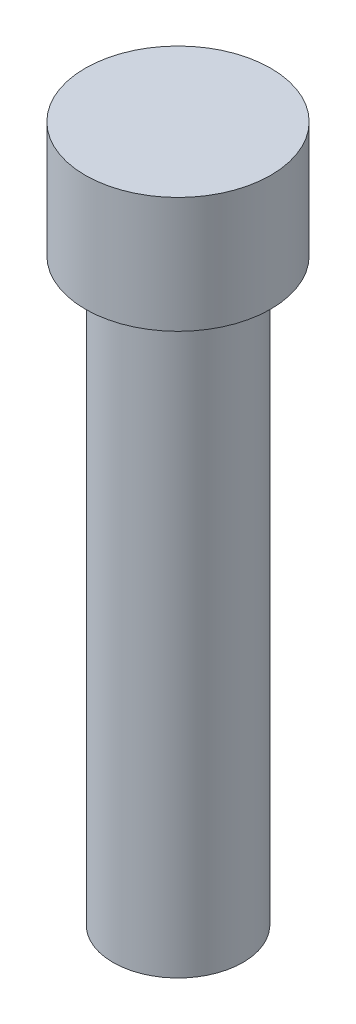
from build123d import *

# Parameters (mm, degrees)
SKETCH_1_R      = 2.8
EXTRUDE_1_DEPTH = 25
SKETCH_2_R      = 4
EXTRUDE_2_DEPTH = 5


with BuildPart() as part:
    # 草图1 → 凸台-拉伸1 (new body)
    with BuildSketch(Plane(origin=(0, 0, 0), x_dir=(1, 0, 0), z_dir=(0, 1, 0))):
        with Locations(Location((0, 0, 0), (0, 0, 270))):
            Circle(SKETCH_1_R)
    extrude(amount=EXTRUDE_1_DEPTH)

    # 草图2 → 凸台-拉伸2 (add)
    with BuildSketch(Plane(origin=(0, 25, 0), x_dir=(1, 0, 0), z_dir=(0, 1, 0))):
        with Locations(Location((0, 0, 0), (0, 0, 270))):
            Circle(SKETCH_2_R)
    extrude(amount=EXTRUDE_2_DEPTH)


solid = part.part
